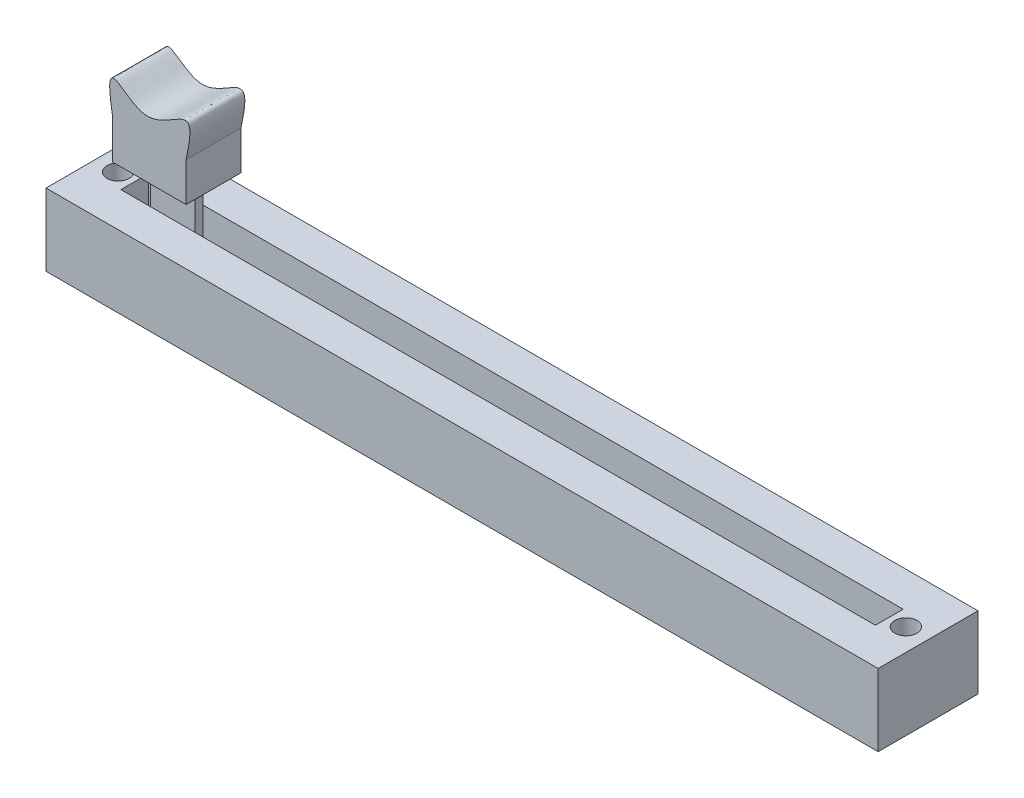
from build123d import *

# Parameters (mm, degrees)
SKETCH1_W                = 75
SKETCH1_H                = 9
SKETCH1_R                = 1
SKETCH1_W_2              = 68
SKETCH1_H_2              = 2.5
BOSS_EXTRUDE1_DEPTH      = 6.5
CUT_EXTRUDE1_START       = 2
SKETCH1_3_W              = 68
SKETCH1_3_H              = 2.5
CUT_EXTRUDE1_DEPTH       = 6.5
SKETCH2_W                = 4
SKETCH2_H                = 0.735412898
BOSS_EXTRUDE2_DEPTH      = 10.5
BOSS_EXTRUDE3_DEPTH      = 0.5
BOSS_EXTRUDE3_DEPTH_BACK = 3
SKETCH3_W                = 6.621243081
SKETCH3_H                = 4.94853177
SKETCH3_W_2              = 4
SKETCH3_H_2              = 0.735412898
BOSS_EXTRUDE4_DEPTH      = 4.948531769


with BuildPart() as part:
    # Sketch1 → Boss-Extrude1 (new body)
    # profile 1 of 2: a face of its own
    with BuildSketch(Plane(origin=(0, 0, 0), x_dir=(1, 0, 0), z_dir=(0, 1, 0))):
        Rectangle(SKETCH1_W, SKETCH1_H)
        with Locations(Location((35.5, 0, 0), (0, 0, 90))):
            Circle(SKETCH1_R, mode=Mode.SUBTRACT)
        with Locations(Location((-35.5, 0, 0), (0, 0, 90))):
            Circle(SKETCH1_R, mode=Mode.SUBTRACT)
        Rectangle(SKETCH1_W_2, SKETCH1_H_2, mode=Mode.SUBTRACT)
    # profile 2 of 2: a face of its own
    with BuildSketch(Plane(origin=(0, 0, 0), x_dir=(1, 0, 0), z_dir=(0, 1, 0))):
        Rectangle(SKETCH1_W_2, SKETCH1_H_2)
    extrude(amount=BOSS_EXTRUDE1_DEPTH)

    # Sketch1<3> → Cut-Extrude1 (cut)
    with BuildSketch(Plane(origin=(0, 0, 0), x_dir=(1, 0, 0), z_dir=(0, 1, 0)).offset(CUT_EXTRUDE1_START)):
        Rectangle(SKETCH1_3_W, SKETCH1_3_H)
    extrude(amount=CUT_EXTRUDE1_DEPTH, mode=Mode.SUBTRACT)


with BuildPart() as body_2:
    # Sketch2 → Boss-Extrude2 (new body)
    with BuildSketch(Plane(origin=(0, 2, 0), x_dir=(1, 0, 0), z_dir=(0, 1, 0))):
        with Locations((-30.210130629, 0)):
            Rectangle(SKETCH2_W, SKETCH2_H)
    extrude(amount=BOSS_EXTRUDE2_DEPTH)


with BuildPart() as body_3:
    # Sketch3 → Boss-Extrude3 (new, two sides: drawn at the far end of the back side and taken through both)
    # profile 1 of 2: a face of its own
    with BuildSketch(Plane(origin=(0, 12.5, 0), x_dir=(1, 0, 0), z_dir=(0, 1, 0)).offset(-BOSS_EXTRUDE3_DEPTH_BACK)):
        with Locations((-30.21013063, 0)):
            Rectangle(SKETCH3_W, SKETCH3_H)
        with Locations((-30.210130629, 0)):
            Rectangle(SKETCH3_W_2, SKETCH3_H_2, mode=Mode.SUBTRACT)
    # profile 2 of 2: a face of its own
    with BuildSketch(Plane(origin=(0, 12.5, 0), x_dir=(1, 0, 0), z_dir=(0, 1, 0)).offset(-BOSS_EXTRUDE3_DEPTH_BACK)):
        with Locations((-30.210130629, 0)):
            Rectangle(SKETCH3_W_2, SKETCH3_H_2)
    extrude(amount=BOSS_EXTRUDE3_DEPTH + BOSS_EXTRUDE3_DEPTH_BACK)

    # Sketch5 → Boss-Extrude4 (add)
    with BuildSketch(Plane.XY.offset(2.474265885)):
        with BuildLine():
            Line((-26.899509089, 9.5), (-26.899509089, 13))
            add(Edge.make_bspline(
                [(-33.52075217, 13), (-34.496425633, 18.64140336), (-30.523211951, 10.611035824), (-25.604321262, 18.774566382), (-26.899509089, 13)],
                knots=[0, 0, 0, 0, 0.47361504, 1, 1, 1, 1], degree=3))
            Line((-33.52075217, 13), (-33.52075217, 9.5))
            Line((-33.52075217, 9.5), (-26.899509089, 9.5))
        make_face()
    extrude(amount=-BOSS_EXTRUDE4_DEPTH)


solid = Compound([part.part, body_2.part, body_3.part])
